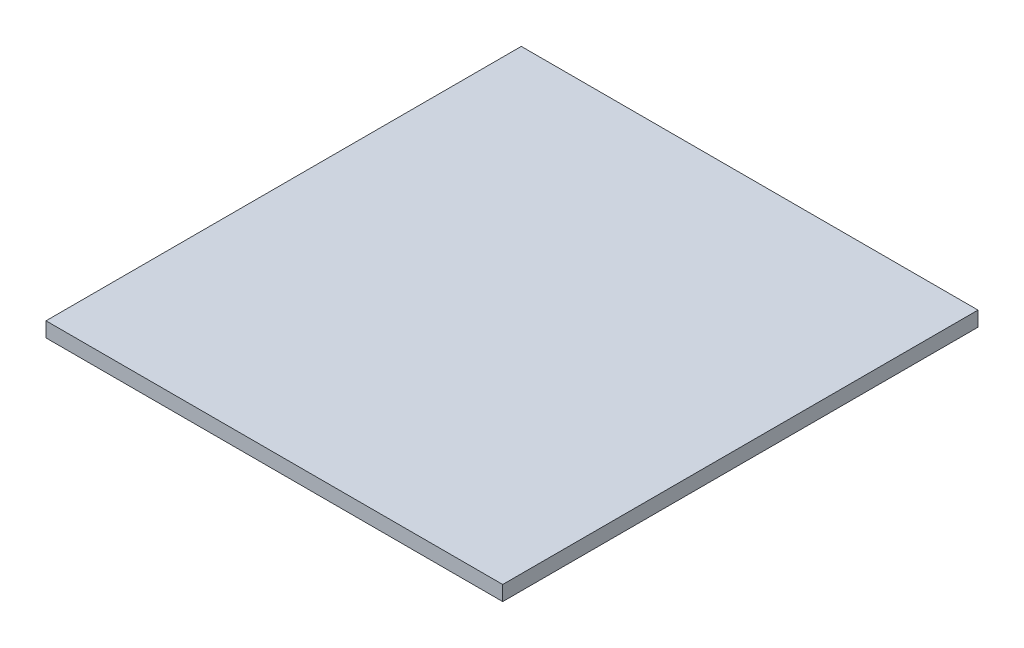
from build123d import *

# Parameters (mm, degrees)
SKETCH1_W           = 390.525
SKETCH1_H           = 406.4
BOSS_EXTRUDE1_DEPTH = 12.7


with BuildPart() as part:
    # Sketch1 → Boss-Extrude1 (new body)
    with BuildSketch(Plane(origin=(0, 0, 0), x_dir=(1, 0, 0), z_dir=(0, 1, 0))):
        with Locations((195.2625, 203.2)):
            Rectangle(SKETCH1_W, SKETCH1_H)
    extrude(amount=BOSS_EXTRUDE1_DEPTH)


solid = part.part
